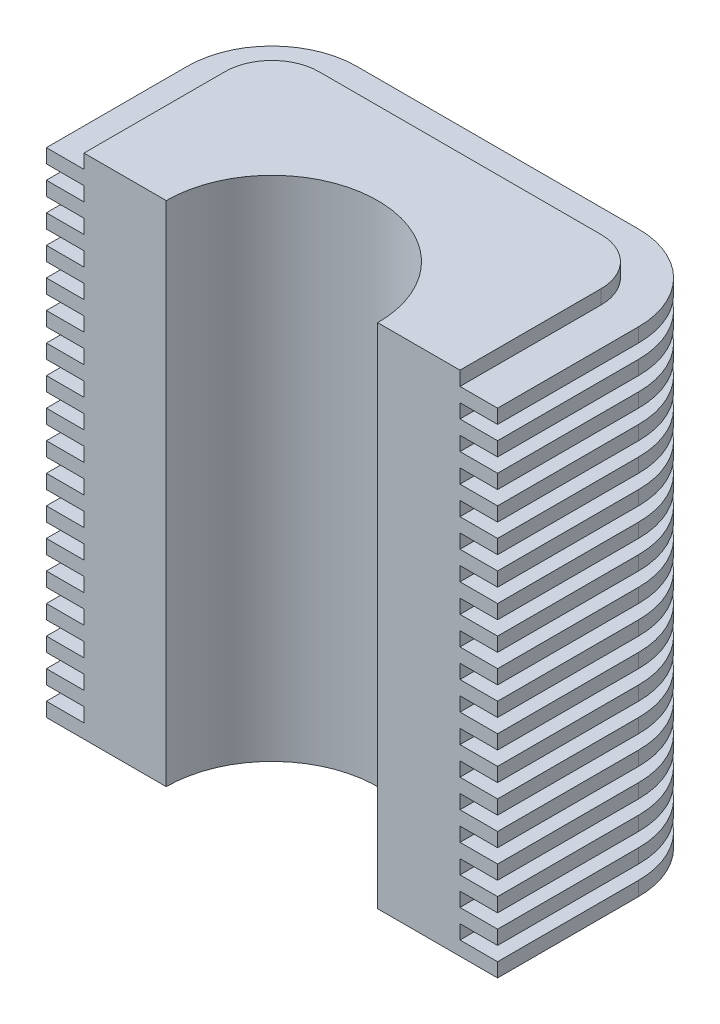
from build123d import *

# Parameters (mm, degrees)
DODANIE_WYCI_GNI_CIE1_DEPTH = 108
ZAOKR_GLENIE1_R             = 10
DODANIE_WYCI_GNI_CIE2_DEPTH = 3
SZYK_LINIOWY1_COUNT         = 18
SZYK_LINIOWY1_PITCH         = 6


with BuildPart() as part:
    # Szkic1 → Dodanie-wyciągnięcie1 (new body)
    with BuildSketch(Plane(origin=(0, 0, 0), x_dir=(1, 0, 0), z_dir=(0, 1, 0))):
        with BuildLine():
            Line((40, 0), (40, 40))
            Line((40, 40), (-40, 40))
            Line((-40, 40), (-40, 0))
            Line((-40, 0), (-22.5, 0))
            ThreePointArc((-22.5, 0), (0, 22.5), (22.5, 0))
            Line((22.5, 0), (40, 0))
        make_face()
    extrude(amount=DODANIE_WYCI_GNI_CIE1_DEPTH)

    # Zaokrąglenie1
    zaokr_glenie1_edges = [part.edges().sort_by_distance(p)[0] for p in [
        (-40, 54, -40),
        (40, 54, -40),
    ]]
    fillet(zaokr_glenie1_edges, radius=ZAOKR_GLENIE1_R)

    # Szkic6 → Dodanie-wyciągnięcie2 (add)
    with BuildSketch(Plane.XZ):
        with BuildLine():
            Line((-48, 0), (-40, 0))
            Line((-40, 0), (-22.5, 0))
            ThreePointArc((-22.5, 0), (0, -22.5), (22.5, 0))
            Line((22.5, 0), (40, 0))
            Line((40, 0), (48, 0))
            Line((48, 0), (48, -30))
            ThreePointArc((48, -30), (42.727922061, -42.727922061), (30, -48))
            Line((30, -48), (-30, -48))
            ThreePointArc((-30, -48), (-42.727922061, -42.727922061), (-48, -30))
            Line((-48, -30), (-48, 0))
        make_face()
    dodanie_wyci_gni_cie2 = extrude(amount=-DODANIE_WYCI_GNI_CIE2_DEPTH)

    # Szyk liniowy1: Dodanie-wyciągnięcie2 ×18
    with Locations(*[(0, i * SZYK_LINIOWY1_PITCH, 0) for i in range(1, SZYK_LINIOWY1_COUNT)]):
        add(dodanie_wyci_gni_cie2)


solid = part.part
